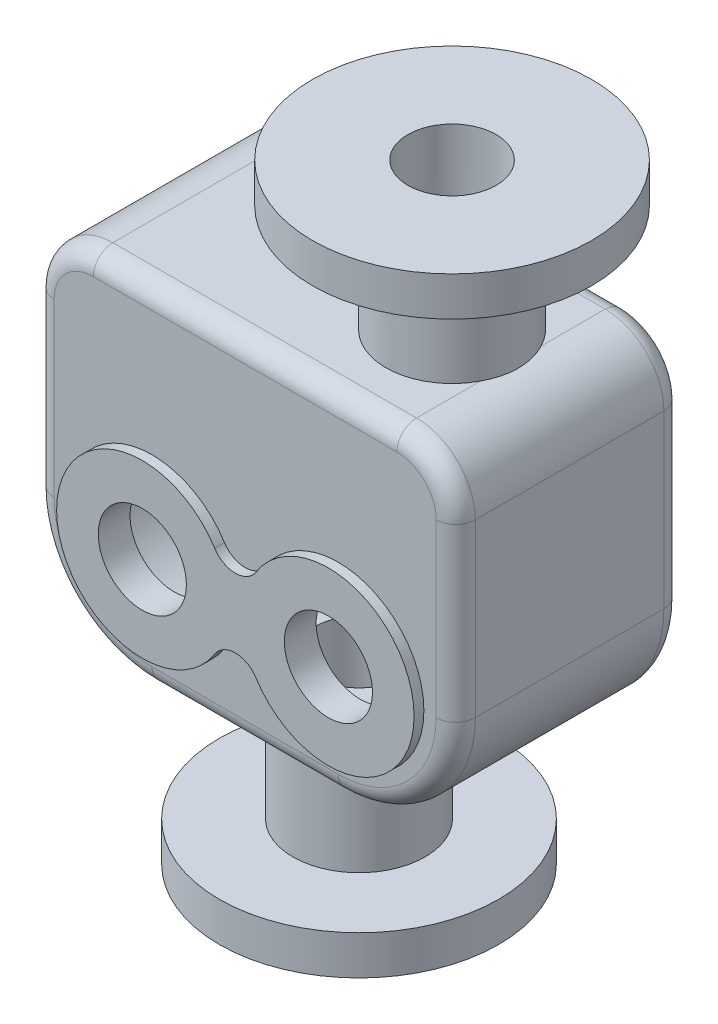
from build123d import *

# Parameters (mm, degrees)
EXTRUDE_1_DEPTH     = 46.5
FILLET_1_R          = 8
SHELL_1_T           = 9
FILLET_2_R          = 3
EXTRUDE_2_DEPTH     = 4
CUT_EXTRUDE_1_REACH = 194.273
SKETCH_3_R          = 18
CUT_EXTRUDE_2_REACH = 194.273
SKETCH_4_R          = 27.5
CUT_EXTRUDE_3_REACH = 291.997
SKETCH_7_R          = 18
CUT_EXTRUDE_4_REACH = 291.997
SKETCH_8_R          = 18


with BuildPart() as part:
    # 草圖1 → 伸長1 (new, symmetric)
    with BuildSketch(Plane.XY):
        with BuildLine():
            Line((-38, 0), (38, 0))
            ThreePointArc((38, 0), (71.941125497, 14.058874503), (86, 48))
            Line((86, 48), (86, 118))
            ThreePointArc((86, 118), (78.970562748, 134.970562748), (62, 142))
            Line((62, 142), (-62, 142))
            ThreePointArc((-62, 142), (-78.970562748, 134.970562748), (-86, 118))
            Line((-86, 118), (-86, 48))
            ThreePointArc((-86, 48), (-71.941125497, 14.058874503), (-38, 0))
        make_face()
    extrude(amount=EXTRUDE_1_DEPTH, both=True)

    # 圓角1
    fillet_1_edges = [part.edges().sort_by_distance(p)[0] for p in [
        (78.970562748, 134.970562748, 46.5),
        (0, 142, 46.5),
        (-78.970562748, 134.970562748, 46.5),
        (-86, 83, 46.5),
        (-71.941125497, 14.058874503, 46.5),
        (0, 0, 46.5),
        (71.941125497, 14.058874503, 46.5),
        (0, 0, -46.5),
        (86, 83, 46.5),
        (-71.941125497, 14.058874503, -46.5),
        (-86, 83, -46.5),
        (-78.970562748, 134.970562748, -46.5),
        (0, 142, -46.5),
        (78.970562748, 134.970562748, -46.5),
        (86, 83, -46.5),
        (71.941125497, 14.058874503, -46.5),
    ]]
    fillet(fillet_1_edges, radius=FILLET_1_R)

    # 薄殼1 (no face opened: a closed hollow body)
    add(offset(amount=-SHELL_1_T, mode=Mode.PRIVATE), mode=Mode.SUBTRACT)

    # 圓角2
    fillet_2_edges = [part.edges().sort_by_distance(p)[0] for p in [
        (65.577164466, 20.422835534, 37.5),
        (77, 83, 37.5),
        (72.606601718, 128.606601718, 37.5),
        (0, 133, -37.5),
        (-72.606601718, 128.606601718, -37.5),
        (-77, 83, -37.5),
        (-65.577164466, 20.422835534, 37.5),
        (0, 9, 37.5),
        (0, 133, 37.5),
        (-72.606601718, 128.606601718, 37.5),
        (-77, 83, 37.5),
        (72.606601718, 128.606601718, -37.5),
        (77, 83, -37.5),
        (65.577164466, 20.422835534, -37.5),
        (0, 9, -37.5),
        (-65.577164466, 20.422835534, -37.5),
    ]]
    fillet(fillet_2_edges, radius=FILLET_2_R)

    # 草圖2 → 伸長2 (add)
    with BuildSketch(Plane.XY.offset(46.5)):
        with BuildLine():
            ThreePointArc((8.444444444, 29.252489877), (73, 48), (8.444444444, 66.747510123))
            ThreePointArc((8.444444444, 66.747510123), (0, 62.103941586), (-8.444444444, 66.747510123))
            ThreePointArc((-8.444444444, 66.747510123), (-73, 48), (-8.444444444, 29.252489877))
            ThreePointArc((-8.444444444, 29.252489877), (0, 33.896058414), (8.444444444, 29.252489877))
        make_face()
    extrude(amount=EXTRUDE_2_DEPTH)

    # 草圖3 → 除料-伸長1 (cut, up to next)
    with BuildSketch(Plane.XY.offset(50.5), mode=Mode.PRIVATE) as cut_extrude_1_sk1:
        with Locations((38, 48)):
            Circle(SKETCH_3_R)
    cut_extrude_1_tool1 = extrude(cut_extrude_1_sk1.sketch, amount=-CUT_EXTRUDE_1_REACH, mode=Mode.PRIVATE) & part.part
    # 草圖3 → 除料-伸長1 (cut, up to next)
    with BuildSketch(Plane.XY.offset(50.5), mode=Mode.PRIVATE) as cut_extrude_1_sk2:
        with Locations((-38, 48)):
            Circle(SKETCH_3_R)
    cut_extrude_1_tool2 = extrude(cut_extrude_1_sk2.sketch, amount=-CUT_EXTRUDE_1_REACH, mode=Mode.PRIVATE) & part.part
    add(cut_extrude_1_tool1.solids().sort_by_distance((38, 48, 50.5))[0], mode=Mode.SUBTRACT)
    add(cut_extrude_1_tool2.solids().sort_by_distance((-38, 48, 50.5))[0], mode=Mode.SUBTRACT)

    # 草圖4 → 除料-伸長2 (cut, up to next)
    with BuildSketch(Plane(origin=(0, 0, -46.5), x_dir=(-1, 0, 0), z_dir=(0, 0, -1)), mode=Mode.PRIVATE) as cut_extrude_2_sk1:
        with Locations((-38, 48)):
            Circle(SKETCH_4_R)
    cut_extrude_2_tool1 = extrude(cut_extrude_2_sk1.sketch, amount=-CUT_EXTRUDE_2_REACH, mode=Mode.PRIVATE) & part.part
    # 草圖4 → 除料-伸長2 (cut, up to next)
    with BuildSketch(Plane(origin=(0, 0, -46.5), x_dir=(-1, 0, 0), z_dir=(0, 0, -1)), mode=Mode.PRIVATE) as cut_extrude_2_sk2:
        with Locations((38, 48)):
            Circle(SKETCH_4_R)
    cut_extrude_2_tool2 = extrude(cut_extrude_2_sk2.sketch, amount=-CUT_EXTRUDE_2_REACH, mode=Mode.PRIVATE) & part.part
    add(cut_extrude_2_tool1.solids().sort_by_distance((38, 48, -46.5))[0], mode=Mode.SUBTRACT)
    add(cut_extrude_2_tool2.solids().sort_by_distance((-38, 48, -46.5))[0], mode=Mode.SUBTRACT)

    # 草圖5 → 旋轉1 (revolve)
    with BuildSketch(Plane.XY, mode=Mode.PRIVATE) as revolve_1_sk:
        Polygon((0, -66), (57, -66), (57, -50), (27, -50), (27, 0), (0, 0), align=None)
    revolve(revolve_1_sk.sketch.rotate(Axis((0, 0, 0), (0, -1, 0)), 90), axis=Axis((0, 0, 0), (0, -1, 0)))

    # 草圖6 → 旋轉2 (revolve)
    with BuildSketch(Plane.XY, mode=Mode.PRIVATE) as revolve_2_sk:
        Polygon((11, 133), (11, 186), (-19, 186), (-19, 202), (38, 202), (38, 133), align=None)
    revolve(revolve_2_sk.sketch.rotate(Axis((38, 124.753510303, 0), (0, 1, 0)), 270), axis=Axis((38, 124.753510303, 0), (0, 1, 0)))

    # 草圖7 → 除料-伸長3 (cut, up to next)
    with BuildSketch(Plane.XZ.offset(66), mode=Mode.PRIVATE) as cut_extrude_3_sk1:
        with Locations(Location((0, 0, 0), (0, 0, 270))):
            Circle(SKETCH_7_R)
    cut_extrude_3_tool1 = extrude(cut_extrude_3_sk1.sketch, amount=-CUT_EXTRUDE_3_REACH, mode=Mode.PRIVATE) & part.part
    add(cut_extrude_3_tool1.solids().sort_by_distance((0, -66, 0))[0], mode=Mode.SUBTRACT)

    # 草圖8 → 除料-伸長4 (cut, up to next)
    with BuildSketch(Plane(origin=(0, 202, 0), x_dir=(-1, 0, 0), z_dir=(0, 1, 0)), mode=Mode.PRIVATE) as cut_extrude_4_sk1:
        with Locations(Location((-38, 0, 0), (0, 0, 90))):
            Circle(SKETCH_8_R)
    cut_extrude_4_tool1 = extrude(cut_extrude_4_sk1.sketch, amount=-CUT_EXTRUDE_4_REACH, mode=Mode.PRIVATE) & part.part
    add(cut_extrude_4_tool1.solids().sort_by_distance((38, 202, 0))[0], mode=Mode.SUBTRACT)


solid = part.part
